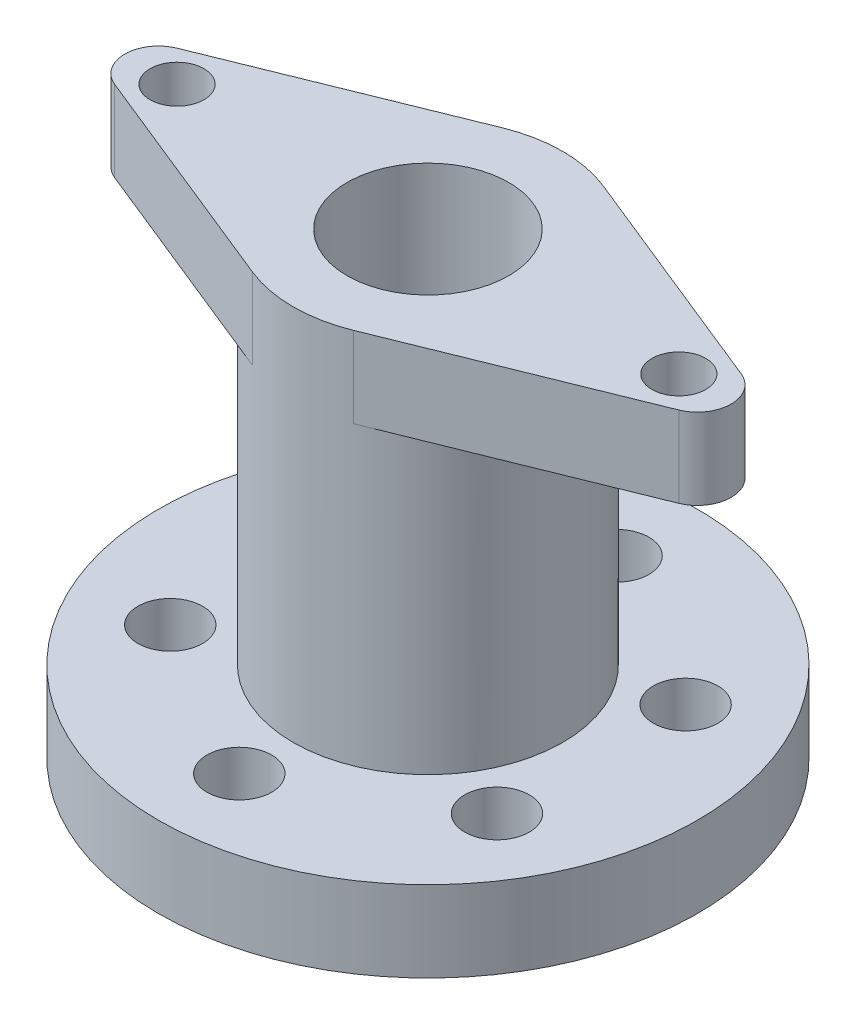
from build123d import *

# Parameters (mm, degrees)
SKETCH1_R           = 500
SKETCH1_R_2         = 60
BOSS_EXTRUDE1_DEPTH = 150
SKETCH3_R           = 250
SKETCH3_R_2         = 150
BOSS_EXTRUDE2_DEPTH = 700
SKETCH5_R           = 50
SKETCH5_R_2         = 250
SKETCH5_R_3         = 150
BOSS_EXTRUDE3_DEPTH = 150


with BuildPart() as part:
    # Sketch1 → Boss-Extrude1 (new body)
    with BuildSketch(Plane(origin=(0, 0, 0), x_dir=(1, 0, 0), z_dir=(0, 1, 0))):
        with Locations(Location((0, 0, 0), (0, 0, 270))):
            Circle(SKETCH1_R)
        with Locations(Location((0, 350, 0), (0, 0, 270))):
            Circle(SKETCH1_R_2, mode=Mode.SUBTRACT)
        with Locations(Location((303.108891325, 175, 0), (0, 0, 270))):
            Circle(SKETCH1_R_2, mode=Mode.SUBTRACT)
        with Locations(Location((303.108891325, -175, 0), (0, 0, 270))):
            Circle(SKETCH1_R_2, mode=Mode.SUBTRACT)
        with Locations(Location((0, -350, 0), (0, 0, 270))):
            Circle(SKETCH1_R_2, mode=Mode.SUBTRACT)
        with Locations(Location((-303.108891325, -175, 0), (0, 0, 270))):
            Circle(SKETCH1_R_2, mode=Mode.SUBTRACT)
        with Locations(Location((-303.108891325, 175, 0), (0, 0, 270))):
            Circle(SKETCH1_R_2, mode=Mode.SUBTRACT)
    extrude(amount=BOSS_EXTRUDE1_DEPTH)

    # Sketch3 → Boss-Extrude2 (add)
    with BuildSketch(Plane(origin=(0, 0, 0), x_dir=(1, 0, 0), z_dir=(0, 1, 0))):
        with Locations(Location((0, 0, 0), (0, 0, 270))):
            Circle(SKETCH3_R)
        with Locations(Location((0, 0, 0), (0, 0, 270))):
            Circle(SKETCH3_R_2, mode=Mode.SUBTRACT)
    extrude(amount=BOSS_EXTRUDE2_DEPTH)

    # Sketch5 → Boss-Extrude3 (add)
    # profile 1 of 3: a face of its own
    with BuildSketch(Plane(origin=(0, 700, 0), x_dir=(1, 0, 0), z_dir=(0, 1, 0))):
        with BuildLine():
            Line((-93.75, 231.756202722), (-523.4375, 57.93905068))
            ThreePointArc((-523.4375, 57.93905068), (-562.5, 0), (-523.4375, -57.93905068))
            Line((-523.4375, -57.93905068), (-93.75, -231.756202722))
            ThreePointArc((-93.75, -231.756202722), (-250, 0), (-93.75, 231.756202722))
        make_face()
        with Locations(Location((-465.559791402, 0, 0), (0, 0, 270))):
            Circle(SKETCH5_R, mode=Mode.SUBTRACT)
    # profile 2 of 3: a face of its own
    with BuildSketch(Plane(origin=(0, 700, 0), x_dir=(1, 0, 0), z_dir=(0, 1, 0))):
        with BuildLine():
            Line((523.4375, 57.93905068), (93.75, 231.756202722))
            ThreePointArc((93.75, 231.756202722), (207.289049397, 139.754248594), (250, 0))
            ThreePointArc((250, 0), (207.289049397, -139.754248594), (93.75, -231.756202722))
            Line((93.75, -231.756202722), (523.4375, -57.93905068))
            ThreePointArc((523.4375, -57.93905068), (562.5, 0), (523.4375, 57.93905068))
        make_face()
        with Locations(Location((465.559791402, 0, 0), (0, 0, 270))):
            Circle(SKETCH5_R, mode=Mode.SUBTRACT)
    # profile 3 of 3: a face of its own
    with BuildSketch(Plane(origin=(0, 700, 0), x_dir=(1, 0, 0), z_dir=(0, 1, 0))):
        with Locations(Location((0, 0, 0), (0, 0, 112.024312837))):
            Circle(SKETCH5_R_2)
        with Locations(Location((0, 0, 0), (0, 0, 270))):
            Circle(SKETCH5_R_3, mode=Mode.SUBTRACT)
    extrude(amount=BOSS_EXTRUDE3_DEPTH)


solid = part.part
